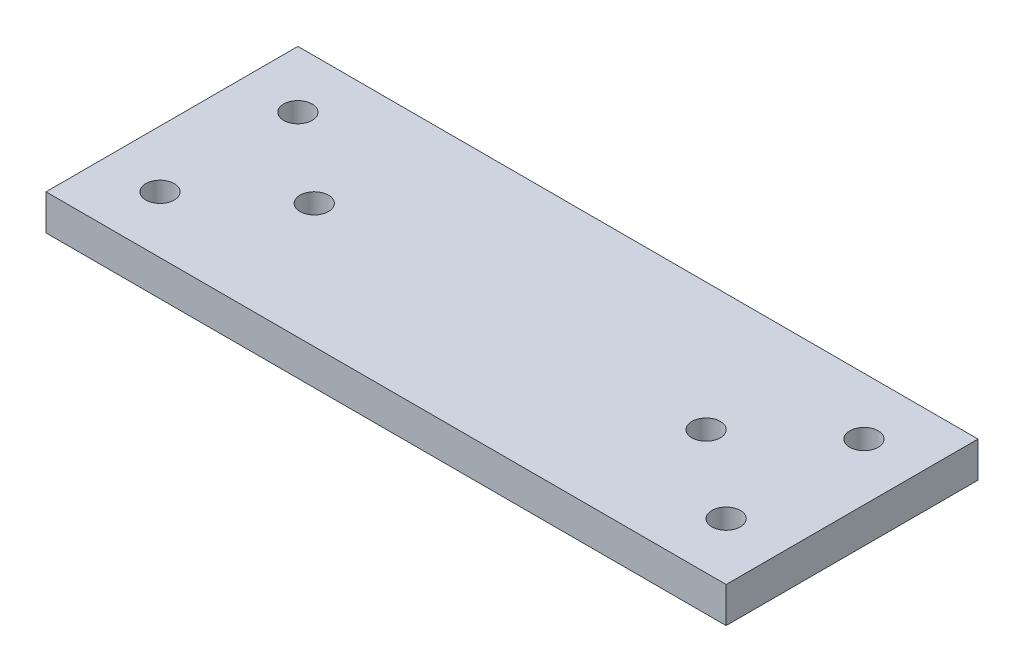
from build123d import *

# Parameters (mm, degrees)
SKETCH_1_W          = 95.45
SKETCH_1_H          = 35.35
SKETCH_1_R          = 2
EXTRUDE_1_DEPTH     = 5
SKETCH_2_R          = 2
CUT_EXTRUDE_1_DEPTH = 5


with BuildPart() as part:
    # 草图1 → 凸台-拉伸1 (new body)
    with BuildSketch(Plane(origin=(0, 0, 0), x_dir=(1, 0, 0), z_dir=(0, 1, 0))):
        with Locations((8.528940217, -2.479891304)):
            Rectangle(SKETCH_1_W, SKETCH_1_H)
        with Locations(Location((-31.196059783, 7.195108696, 0), (0, 0, 270))):
            Circle(SKETCH_1_R, mode=Mode.SUBTRACT)
        with Locations(Location((-31.196059783, -12.154891304, 0), (0, 0, 270))):
            Circle(SKETCH_1_R, mode=Mode.SUBTRACT)
        with Locations(Location((48.253940217, 7.195108696, 0), (0, 0, 270))):
            Circle(SKETCH_1_R, mode=Mode.SUBTRACT)
        with Locations(Location((48.253940217, -12.154891304, 0), (0, 0, 270))):
            Circle(SKETCH_1_R, mode=Mode.SUBTRACT)
    extrude(amount=EXTRUDE_1_DEPTH)

    # 草图2 → 切除-拉伸1 (cut)
    with BuildSketch(Plane(origin=(0, 5, 0), x_dir=(1, 0, 0), z_dir=(0, 1, 0))):
        with Locations(Location((-18.971059783, -2.735165491, 0), (0, 0, 270))):
            Circle(SKETCH_2_R)
        with Locations(Location((36.028940217, -2.735165491, 0), (0, 0, 270))):
            Circle(SKETCH_2_R)
    extrude(amount=-CUT_EXTRUDE_1_DEPTH, mode=Mode.SUBTRACT)


solid = part.part
